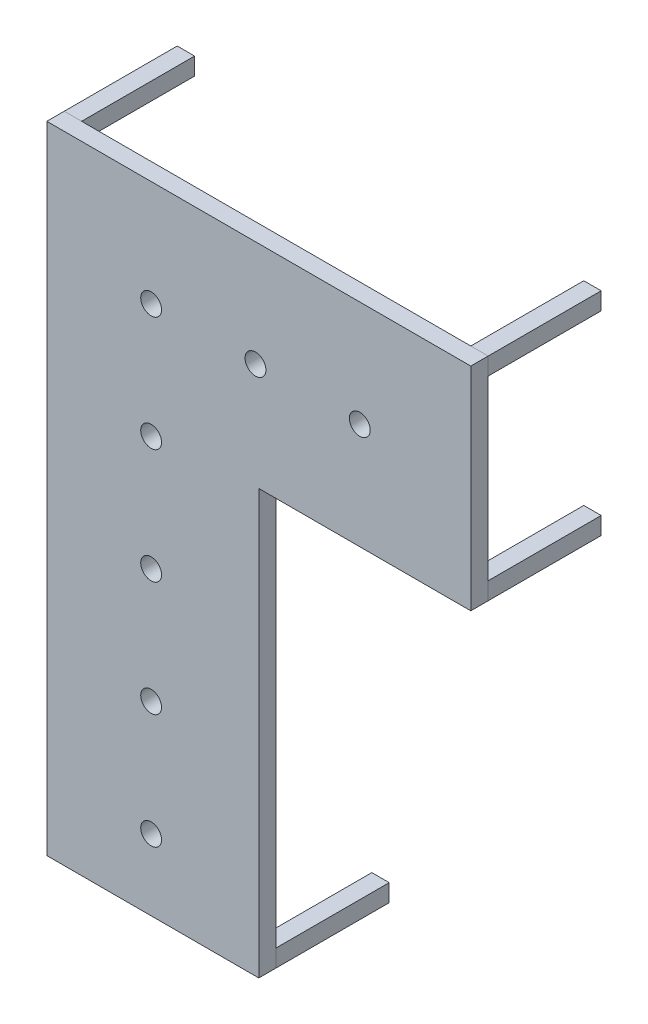
from build123d import *

# Parameters (mm, degrees)
BOSS_EXTRUDE1_DEPTH   = 100
SKETCH4_W             = 100
SKETCH4_H             = 100
BOSS_EXTRUDE2_DEPTH   = 650
BOSS_EXTRUDE2_2_DEPTH = 650
BOSS_EXTRUDE2_3_DEPTH = 650
BOSS_EXTRUDE2_4_DEPTH = 650
BOSS_EXTRUDE2_5_DEPTH = 650
BOSS_EXTRUDE2_6_DEPTH = 650
BOSS_EXTRUDE2_7_DEPTH = 650
SKETCH5_R             = 60
CUT_EXTRUDE2_DEPTH    = 4444.684543259


with BuildPart() as part:
    # Sketch3 → Boss-Extrude1 (new body)
    with BuildSketch(Plane.XY):
        Polygon((2438.4, -1219.2), (2438.4, 0), (0, 0), (0, -3657.6), (1219.2, -3657.6), (1219.2, -1219.2), align=None)
    extrude(amount=BOSS_EXTRUDE1_DEPTH)

    # Sketch5 → Cut-Extrude2 (cut, through all)
    with BuildSketch(Plane(origin=(0, 0, 0), x_dir=(-1, 0, 0), z_dir=(0, 0, -1))):
        with Locations((-600, -3249.2)):
            Circle(SKETCH5_R)
        with Locations((-600, -2589.2)):
            Circle(SKETCH5_R)
        with Locations((-600, -1929.2)):
            Circle(SKETCH5_R)
        with Locations((-600, -1269.2)):
            Circle(SKETCH5_R)
        with Locations((-600, -609.2)):
            Circle(SKETCH5_R)
        with Locations((-1200, -609.2)):
            Circle(SKETCH5_R)
        with Locations((-1800, -609.2)):
            Circle(SKETCH5_R)
    extrude(amount=-CUT_EXTRUDE2_DEPTH, mode=Mode.SUBTRACT)


with BuildPart() as body_2:
    # Sketch4 → Boss-Extrude2 (new body)
    with BuildSketch(Plane(origin=(0, 0, 0), x_dir=(-1, 0, 0), z_dir=(0, 0, -1))):
        with Locations((-2388.4, -50)):
            Rectangle(SKETCH4_W, SKETCH4_H)
    extrude(amount=BOSS_EXTRUDE2_DEPTH)


with BuildPart() as body_3:
    # Sketch4 → Boss-Extrude2 2 (new body)
    with BuildSketch(Plane(origin=(0, 0, 0), x_dir=(-1, 0, 0), z_dir=(0, 0, -1))):
        with Locations((-50, -3607.6)):
            Rectangle(SKETCH4_W, SKETCH4_H)
    extrude(amount=BOSS_EXTRUDE2_2_DEPTH)


with BuildPart() as body_4:
    # Sketch4 → Boss-Extrude2 3 (new body)
    with BuildSketch(Plane(origin=(0, 0, 0), x_dir=(-1, 0, 0), z_dir=(0, 0, -1))):
        with Locations((-50, -50)):
            Rectangle(SKETCH4_W, SKETCH4_H)
    extrude(amount=BOSS_EXTRUDE2_3_DEPTH)


with BuildPart() as body_5:
    # Sketch4 → Boss-Extrude2 4 (new body)
    with BuildSketch(Plane(origin=(0, 0, 0), x_dir=(-1, 0, 0), z_dir=(0, 0, -1))):
        with Locations((-1169.2, -3607.6)):
            Rectangle(SKETCH4_W, SKETCH4_H)
    extrude(amount=BOSS_EXTRUDE2_4_DEPTH)


with BuildPart() as body_6:
    # Sketch4 → Boss-Extrude2 5 (new body)
    with BuildSketch(Plane(origin=(0, 0, 0), x_dir=(-1, 0, 0), z_dir=(0, 0, -1))):
        with Locations((-1169.2, -1169.2)):
            Rectangle(SKETCH4_W, SKETCH4_H)
    extrude(amount=BOSS_EXTRUDE2_5_DEPTH)


with BuildPart() as body_7:
    # Sketch4 → Boss-Extrude2 6 (new body)
    with BuildSketch(Plane(origin=(0, 0, 0), x_dir=(-1, 0, 0), z_dir=(0, 0, -1))):
        with Locations((-2388.4, -1169.2)):
            Rectangle(SKETCH4_W, SKETCH4_H)
    extrude(amount=BOSS_EXTRUDE2_6_DEPTH)


with BuildPart() as body_8:
    # Sketch4 → Boss-Extrude2 7 (new body)
    with BuildSketch(Plane(origin=(0, 0, 0), x_dir=(-1, 0, 0), z_dir=(0, 0, -1))):
        with Locations((-50, -1169.2)):
            Rectangle(SKETCH4_W, SKETCH4_H)
    extrude(amount=BOSS_EXTRUDE2_7_DEPTH)


solid = Compound([part.part, body_2.part, body_3.part, body_4.part, body_5.part, body_6.part, body_7.part, body_8.part])
